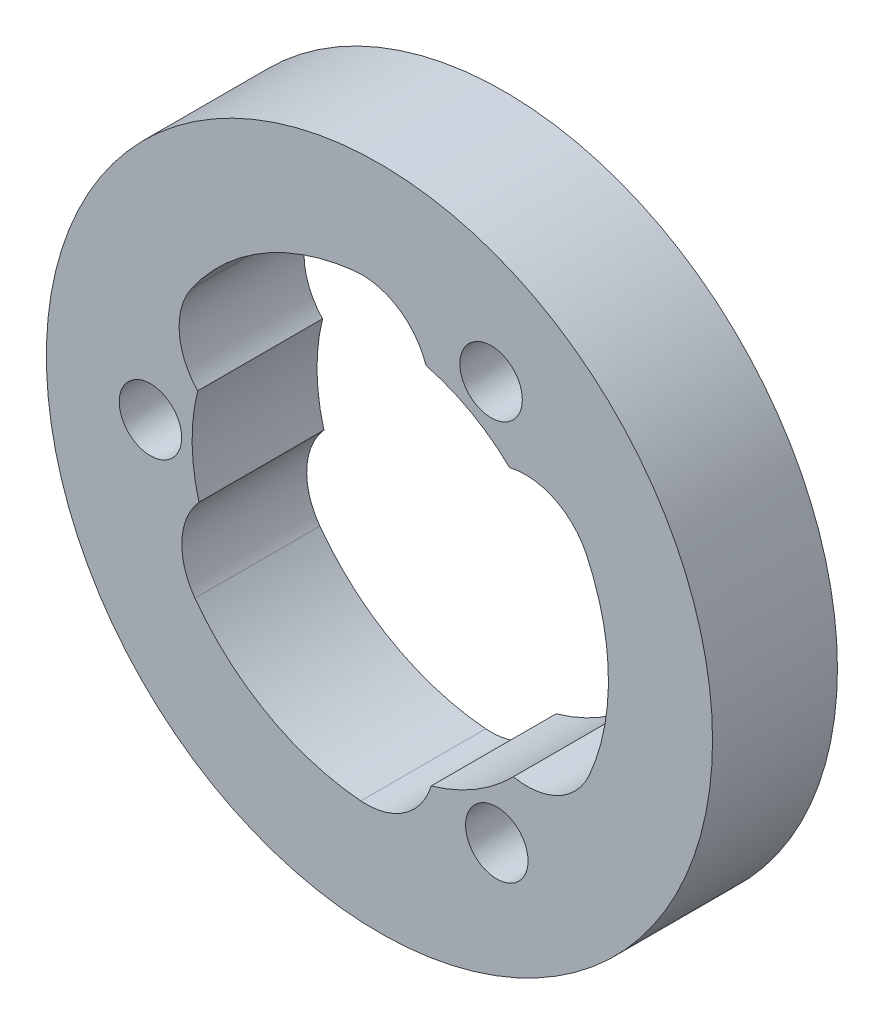
from build123d import *

# Parameters (mm, degrees)
ESQUISSE1_R        = 16
ESQUISSE1_R_2      = 1.5
BOSS_EXTRU_1_DEPTH = 6


with BuildPart() as part:
    # Esquisse1 → Boss.-Extru.1 (new body)
    with BuildSketch(Plane.XY):
        Circle(ESQUISSE1_R)
        with Locations((-10.998860664, -0.15831643)):
            Circle(ESQUISSE1_R_2, mode=Mode.SUBTRACT)
        with Locations((5.362324282, 9.604450963)):
            Circle(ESQUISSE1_R_2, mode=Mode.SUBTRACT)
        with Locations((5.636536382, -9.446134533)):
            Circle(ESQUISSE1_R_2, mode=Mode.SUBTRACT)
        with BuildLine():
            ThreePointArc((-8.667289778, -2.424476831), (-9.490533908, -4.435287826), (-8.862790309, -6.515439198))
            ThreePointArc((-8.862790309, -6.515439198), (-5.362324282, -9.604450963), (-0.895963785, -10.963450593))
            ThreePointArc((-0.895963785, -10.963450593), (1.204207331, -10.406339254), (2.483990345, -8.650421491))
            ThreePointArc((2.483990345, -8.650421491), (4.611711585, -7.728655527), (6.433303415, -6.293854715))
            ThreePointArc((6.433303415, -6.293854715), (8.586338885, -6.001399547), (10.073931017, -4.417681957))
            ThreePointArc((10.073931017, -4.417681957), (10.998860664, 0.15831643), (9.942608619, 4.705797898))
            ThreePointArc((9.942608619, 4.705797898), (8.410050489, 6.246043767), (6.249489591, 6.476409487))
            ThreePointArc((6.249489591, 6.476409487), (4.387356231, 7.858187151), (2.233986363, 8.718331545))
            ThreePointArc((2.233986363, 8.718331545), (0.904195024, 10.436687373), (-1.211140708, 10.933121155))
            ThreePointArc((-1.211140708, 10.933121155), (-5.636536382, 9.446134533), (-9.046644834, 6.257652695))
            ThreePointArc((-9.046644834, 6.257652695), (-9.61425782, 4.160295487), (-8.733479937, 2.174012003))
            ThreePointArc((-8.733479937, 2.174012003), (-8.999067816, -0.129531624), (-8.667289778, -2.424476831))
        make_face(mode=Mode.SUBTRACT)
    extrude(amount=BOSS_EXTRU_1_DEPTH)


solid = part.part
